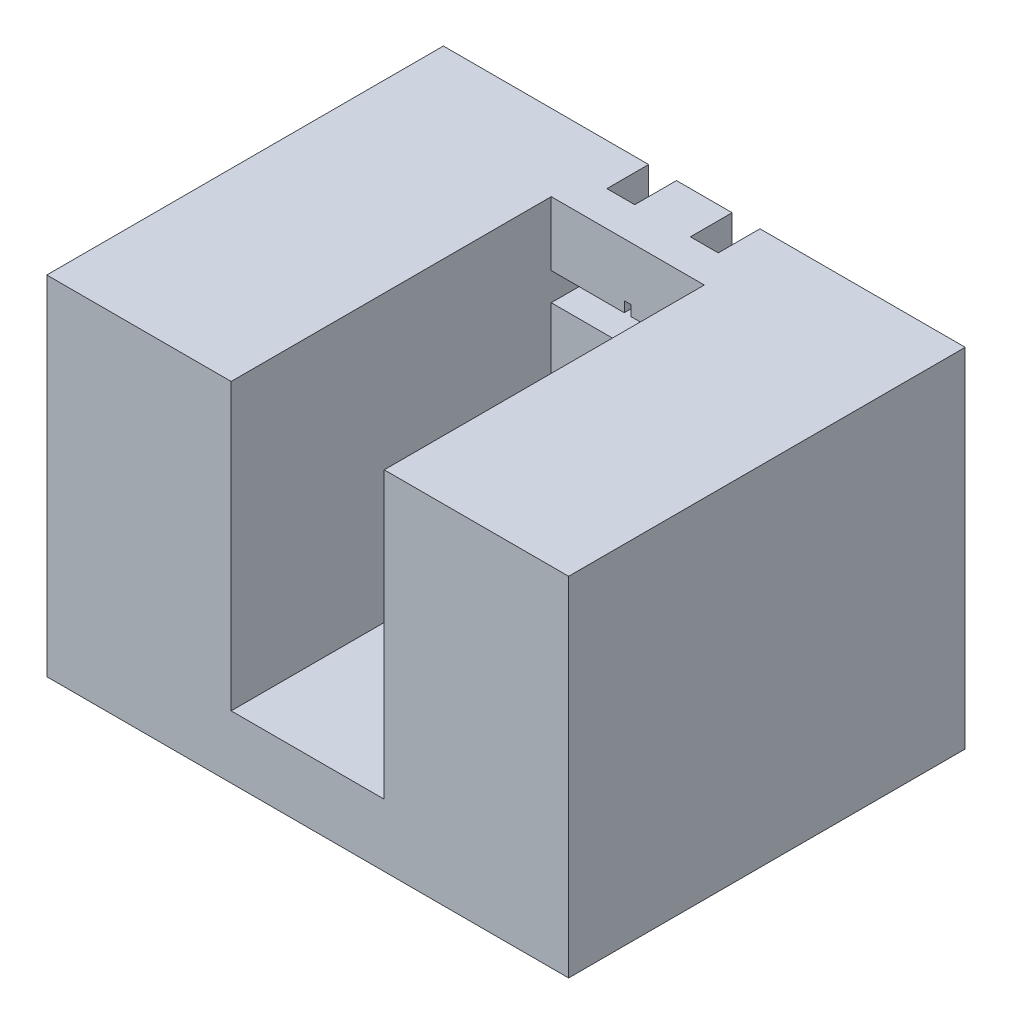
from build123d import *

# Parameters (mm, degrees)
SKETCH1_W           = 75
SKETCH1_H           = 50
BOSS_EXTRUDE1_DEPTH = 57
SKETCH2_W           = 22
SKETCH2_H           = 41
CUT_EXTRUDE1_DEPTH  = 46
SKETCH4_W           = 22
SKETCH4_H           = 4
CUT_EXTRUDE2_DEPTH  = 65.399145957
SKETCH5_W           = 4
SKETCH5_H           = 22.4
CUT_EXTRUDE3_DEPTH  = 6
SKETCH6_W           = 1
SKETCH6_H           = 1.5
CUT_EXTRUDE4_DEPTH  = 4.5


with BuildPart() as part:
    # Sketch1 → Boss-Extrude1 (new body)
    with BuildSketch(Plane.XY):
        Rectangle(SKETCH1_W, SKETCH1_H)
    extrude(amount=BOSS_EXTRUDE1_DEPTH)

    # Sketch2 → Cut-Extrude1 (cut)
    with BuildSketch(Plane.XY.offset(57)):
        with Locations((0, 4.5)):
            Rectangle(SKETCH2_W, SKETCH2_H)
    extrude(amount=-CUT_EXTRUDE1_DEPTH, mode=Mode.SUBTRACT)

    # Sketch4 → Cut-Extrude2 (cut, through all)
    with BuildSketch(Plane.XY.offset(11)):
        with Locations((0, 13.8)):
            Rectangle(SKETCH4_W, SKETCH4_H)
    extrude(amount=-CUT_EXTRUDE2_DEPTH, mode=Mode.SUBTRACT)

    # Sketch5 → Cut-Extrude3 (cut)
    with BuildSketch(Plane(origin=(0, 0, 0), x_dir=(-1, 0, 0), z_dir=(0, 0, -1))):
        with Locations((-6, 13.8)):
            Rectangle(SKETCH5_W, SKETCH5_H)
        with Locations((6, 13.8)):
            Rectangle(SKETCH5_W, SKETCH5_H)
    extrude(amount=-CUT_EXTRUDE3_DEPTH, mode=Mode.SUBTRACT)

    # Sketch6 → Cut-Extrude4 (cut)
    with BuildSketch(Plane.XY.offset(11)):
        with Locations((0, 16.55)):
            Rectangle(SKETCH6_W, SKETCH6_H)
    extrude(amount=-CUT_EXTRUDE4_DEPTH, mode=Mode.SUBTRACT)


solid = part.part
